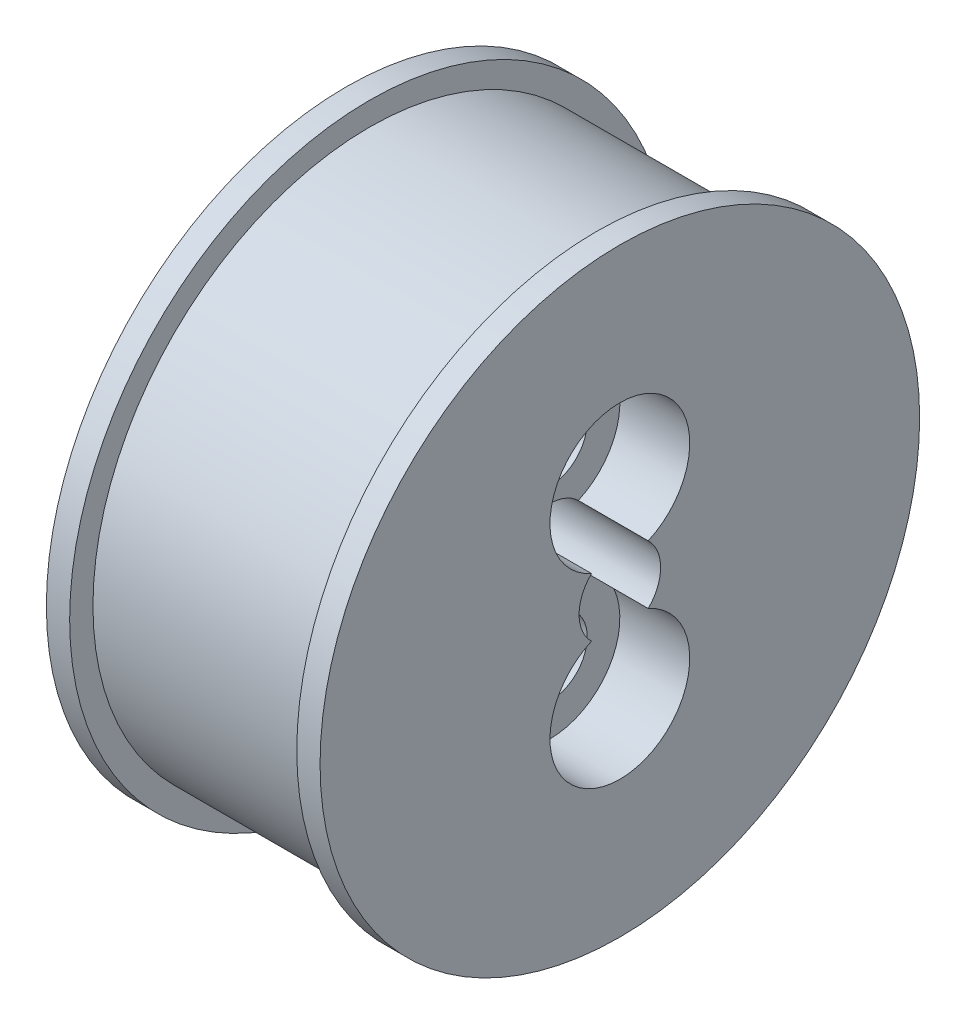
from build123d import *

# Parameters (mm, degrees)
SKETCH7_R                      = 1.75
CUT_EXTRUDE1_DEPTH             = 22.664170882
CBORE_FOR_M3_SHCS1_D           = 3.2
CBORE_FOR_M3_SHCS1_CBORE_D     = 6
CBORE_FOR_M3_SHCS1_CBORE_DEPTH = 3


with BuildPart() as part:
    # Sketch2 → Revolve1 (revolve)
    with BuildSketch(Plane.XY):
        Polygon((0, 0), (0, 12.87), (1, 12.87), (1, 11.87), (10.75, 11.87), (10.75, 12.87), (11.75, 12.87), (11.75, 0), align=None)
    revolve(axis=Axis((11.75, 0, 0), (-1, 0, 0)))

    # Sketch7 → Cut-Extrude1 (cut, through all)
    with BuildSketch(Plane(origin=(11.75, 0, 0), x_dir=(0, 0, -1), z_dir=(1, 0, 0))):
        with Locations(Location((0, 0, 0), (0, 0, 90))):
            Circle(SKETCH7_R)
    extrude(amount=-CUT_EXTRUDE1_DEPTH, mode=Mode.SUBTRACT)

    # CBORE for M3 SHCS1 (through all)
    with Locations(Plane(origin=(11.75, 0, 0), x_dir=(0, 0, -1), z_dir=(1, 0, 0))):
        with Locations((0, -4), (0, 4)):
            CounterBoreHole(CBORE_FOR_M3_SHCS1_D / 2, CBORE_FOR_M3_SHCS1_CBORE_D / 2, CBORE_FOR_M3_SHCS1_CBORE_DEPTH)


solid = part.part
